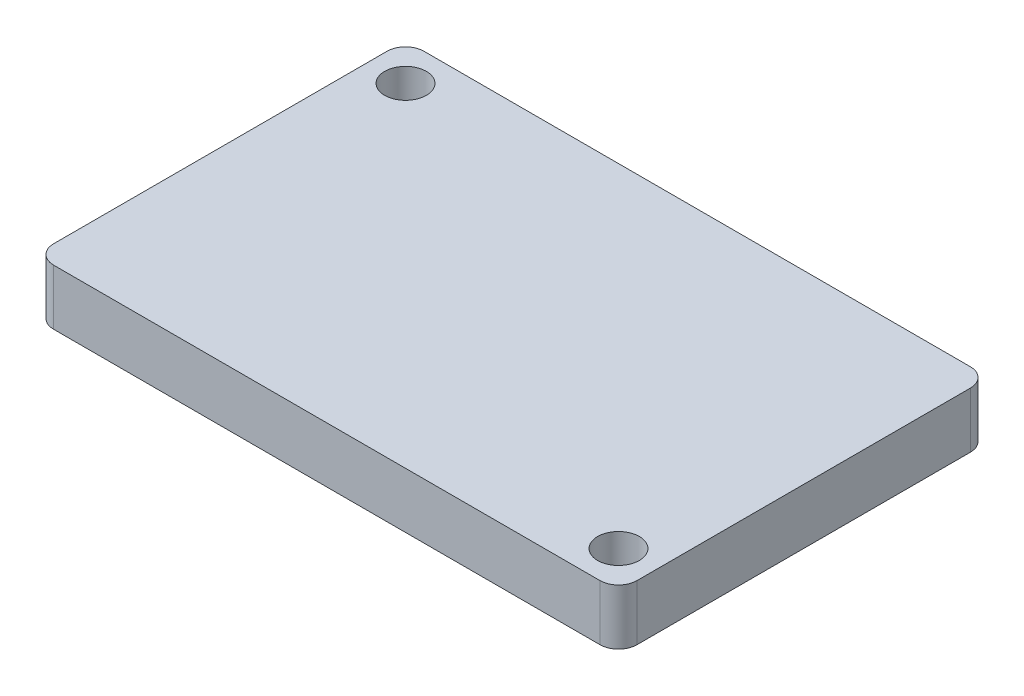
from build123d import *

# Parameters (mm, degrees)
SKETCH_1_W          = 63
SKETCH_1_H          = 6
BLOCKEXTRUDE_DEPTH  = 40
FILLET_2_R          = 2
SKETCH_2_R          = 2.25
MOUNTING_HOLE_DEPTH = 75.866547937
SKETCH_3_R          = 2.25
CUT_EXTRUDE_2_DEPTH = 75.866547937


with BuildPart() as part:
    # 草图1 → BlockExtrude (new body)
    with BuildSketch(Plane.XY):
        with Locations((31.5, 3)):
            Rectangle(SKETCH_1_W, SKETCH_1_H)
    extrude(amount=BLOCKEXTRUDE_DEPTH)

    # Fillet 2
    fillet_2_edges = [part.edges().sort_by_distance(p)[0] for p in [
        (63, 3, 40),
        (0, 3, 40),
        (63, 3, 0),
        (0, 3, 0),
    ]]
    fillet(fillet_2_edges, radius=FILLET_2_R)

    # 草图2 → Mounting_hole (cut, through all)
    with BuildSketch(Plane(origin=(0, 6, 0), x_dir=(1, 0, 0), z_dir=(0, 1, 0))):
        with Locations(Location((4, -4, 0), (0, 0, 270))):
            Circle(SKETCH_2_R)
    extrude(amount=-MOUNTING_HOLE_DEPTH, mode=Mode.SUBTRACT)

    # 草图3 → 切除-拉伸2 (cut, through all)
    with BuildSketch(Plane(origin=(0, 6, 0), x_dir=(1, 0, 0), z_dir=(0, 1, 0))):
        with Locations(Location((59, -36, 0), (0, 0, 270))):
            Circle(SKETCH_3_R)
    extrude(amount=-CUT_EXTRUDE_2_DEPTH, mode=Mode.SUBTRACT)


solid = part.part
